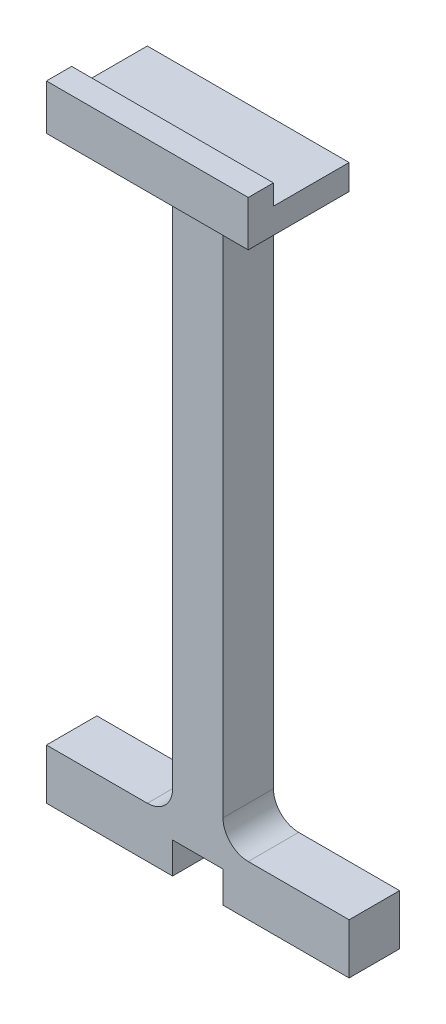
from build123d import *

# Parameters (mm, degrees)
BOSS_EXTRUDE1_DEPTH = 5
SKETCH3_W           = 40
SKETCH3_H           = 10
BOSS_EXTRUDE2_DEPTH = 5
SKETCH4_W           = 40
SKETCH4_H           = 5
BOSS_EXTRUDE3_DEPTH = 4
SKETCH7_W           = 10
SKETCH7_H           = 6.2
CUT_EXTRUDE1_DEPTH  = 75.540257579
SKETCH8_R           = 2
CUT_EXTRUDE2_DEPTH  = 6
FILLET3_R           = 5


with BuildPart() as part:
    # Sketch1 → Boss-Extrude1 (new, symmetric)
    with BuildSketch(Plane.XY):
        Polygon((5, -57.5), (30, -57.5), (30, -67.5), (-30, -67.5), (-30, -57.5), (-5, -57.5), (-5, 57.5), (-20, 57.5), (-20, 62.5), (20, 62.5), (20, 57.5), (5, 57.5), align=None)
    extrude(amount=BOSS_EXTRUDE1_DEPTH, both=True)

    # Sketch3 → Boss-Extrude2 (add)
    with BuildSketch(Plane(origin=(0, 62.5, 0), x_dir=(1, 0, 0), z_dir=(0, 1, 0))):
        with Locations((0, -10)):
            Rectangle(SKETCH3_W, SKETCH3_H)
    extrude(amount=-BOSS_EXTRUDE2_DEPTH)

    # Sketch4 → Boss-Extrude3 (add)
    with BuildSketch(Plane(origin=(0, 62.5, 0), x_dir=(1, 0, 0), z_dir=(0, 1, 0))):
        with Locations((0, -12.5)):
            Rectangle(SKETCH4_W, SKETCH4_H)
    extrude(amount=BOSS_EXTRUDE3_DEPTH)

    # Sketch7 → Cut-Extrude1 (cut, through all)
    with BuildSketch(Plane.XY.offset(5)):
        with Locations((0, -64.4)):
            Rectangle(SKETCH7_W, SKETCH7_H)
    extrude(amount=-CUT_EXTRUDE1_DEPTH, mode=Mode.SUBTRACT)

    # Sketch8 → Cut-Extrude2 (cut)
    with BuildSketch(Plane.XZ.offset(61.3)):
        with Locations(Location((0, 0, 0), (0, 0, 270))):
            Circle(SKETCH8_R)
    extrude(amount=-CUT_EXTRUDE2_DEPTH, mode=Mode.SUBTRACT)

    # Fillet3
    fillet3_edges = [part.edges().sort_by_distance(p)[0] for p in [
        (5, -57.5, 0),
        (-5, -57.5, 0),
        (-5, 57.5, 0),
        (5, 57.5, 0),
        (0, 57.5, 5),
    ]]
    fillet(fillet3_edges, radius=FILLET3_R)


solid = part.part
